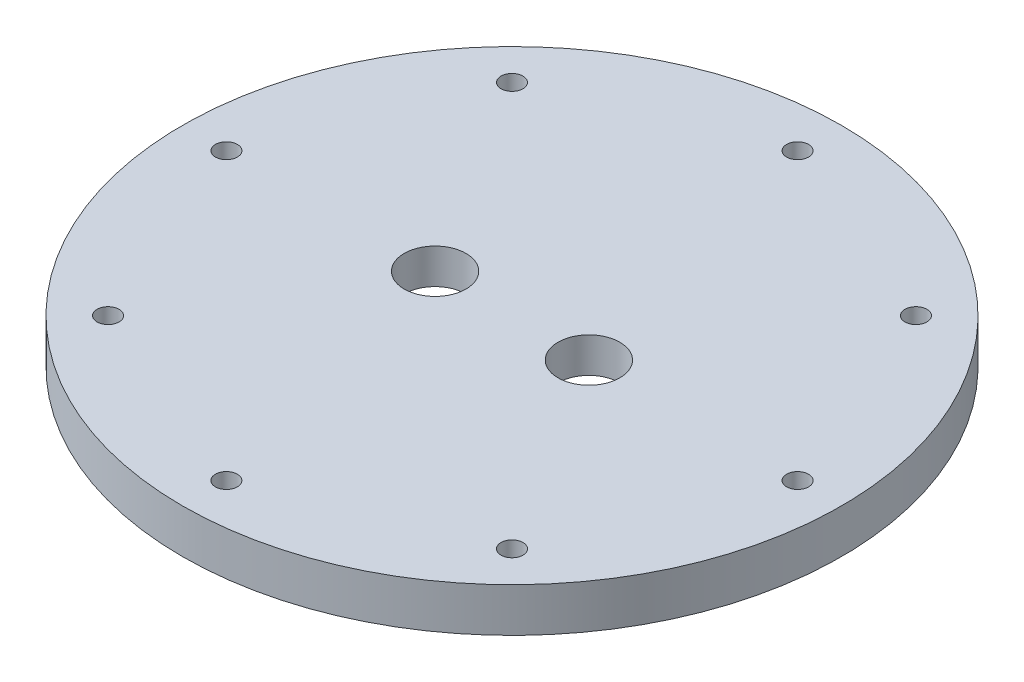
from build123d import *

# Parameters (mm, degrees)
SKETCH1_R                            = 95.25
BOSS_EXTRUDE1_DEPTH                  = 12.7
F_1_4_0_25_DIAMETER_HOLE1_D          = 6.35
CIRPATTERN1_COUNT                    = 8
SKETCH7_R                            = 69.9135
CUT_EXTRUDE3_DEPTH                   = 2.54
SKETCH2_R                            = 68.3133
SKETCH2_R_2                          = 66.1289
CUT_EXTRUDE1_DEPTH                   = 1.3208
F_45_64_0_70313_DIAMETER_HOLE1_D     = 17.859502
F_45_64_0_70313_DIAMETER_HOLE1_DEPTH = 25.4
F_45_64_0_70313_DIAMETER_HOLE1_TIP   = 5.365535714


with BuildPart() as part:
    # Sketch1 → Boss-Extrude1 (new body)
    with BuildSketch(Plane(origin=(0, 0, 0), x_dir=(1, 0, 0), z_dir=(0, 1, 0))):
        with Locations(Location((0, 0, 0), (0, 0, 270))):
            Circle(SKETCH1_R)
    extrude(amount=BOSS_EXTRUDE1_DEPTH)

    # 1/4 (0.25) Diameter Hole1 (through all)
    with Locations(Plane(origin=(0, 0, 0), x_dir=(-1, 0, 0), z_dir=(0, -1, 0))):
        with Locations((0, -82.55)):
            f_1_4_0_25_diameter_hole1 = Hole(F_1_4_0_25_DIAMETER_HOLE1_D / 2)

    # CirPattern1: 1/4 (0.25) Diameter Hole1 ×8 about axis
    cirpattern1_axis = Axis((0, 0, 0), (0, 1, 0))
    for i in range(1, CIRPATTERN1_COUNT):
        add(f_1_4_0_25_diameter_hole1.rotate(cirpattern1_axis, i * 360 / CIRPATTERN1_COUNT), mode=Mode.SUBTRACT)

    # Sketch7 → Cut-Extrude3 (cut)
    with BuildSketch(Plane(origin=(0, 0, 0), x_dir=(-1, 0, 0), z_dir=(0, -1, 0))):
        with Locations(Location((0, 0, 0), (0, 0, 90))):
            Circle(SKETCH7_R)
    extrude(amount=-CUT_EXTRUDE3_DEPTH, mode=Mode.SUBTRACT)

    # Sketch2 → Cut-Extrude1 (cut)
    with BuildSketch(Plane.XZ.offset(-2.54)):
        with Locations(Location((0, 0, 0), (0, 0, 270))):
            Circle(SKETCH2_R)
        with Locations(Location((0, 0, 0), (0, 0, 270))):
            Circle(SKETCH2_R_2, mode=Mode.SUBTRACT)
    extrude(amount=-CUT_EXTRUDE1_DEPTH, mode=Mode.SUBTRACT)

    # 45/64 (0.70313) Diameter Hole1
    with Locations(Plane(origin=(0, 2.54, 0), x_dir=(-1, 0, 0), z_dir=(0, -1, 0))):
        with Locations((22.225, 0), (-22.225, 0)):
            Hole(F_45_64_0_70313_DIAMETER_HOLE1_D / 2, depth=F_45_64_0_70313_DIAMETER_HOLE1_DEPTH)
            with Locations((0, 0, -(F_45_64_0_70313_DIAMETER_HOLE1_DEPTH + F_45_64_0_70313_DIAMETER_HOLE1_TIP / 2))):  # 118° drill point
                Cone(0, F_45_64_0_70313_DIAMETER_HOLE1_D / 2, F_45_64_0_70313_DIAMETER_HOLE1_TIP, mode=Mode.SUBTRACT)


solid = part.part
